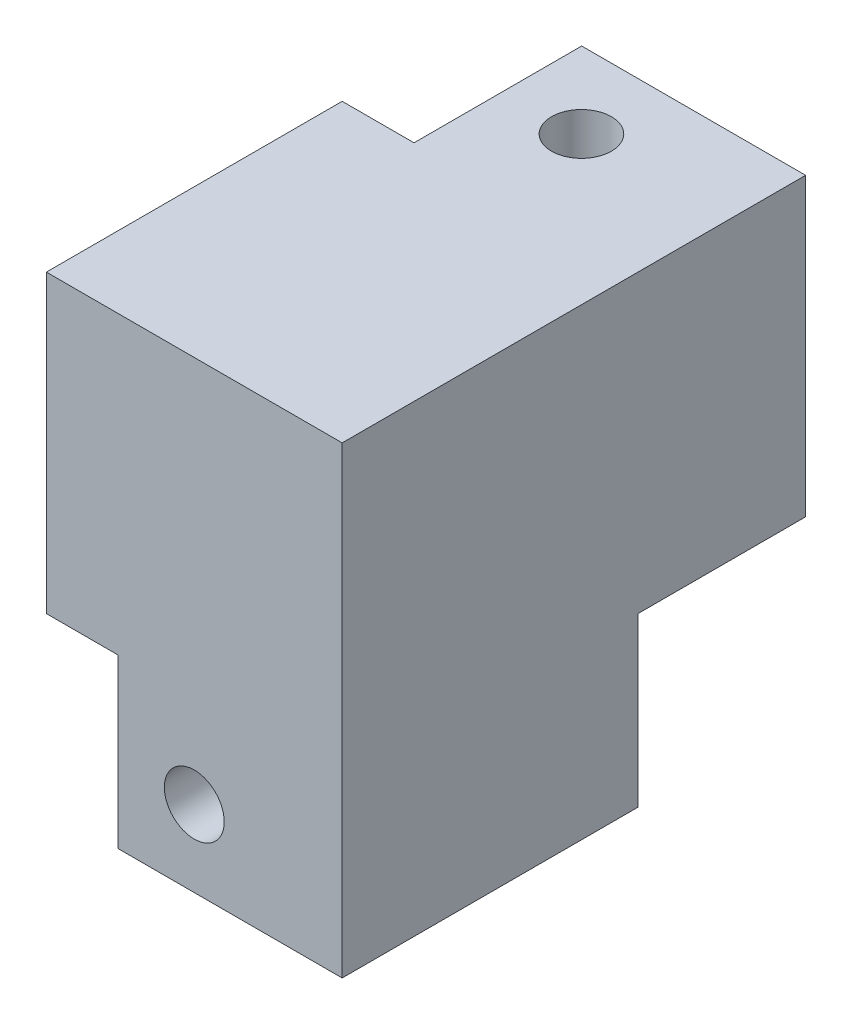
from build123d import *

# Parameters (mm, degrees)
SKETCH_1_W          = 24.7
SKETCH_1_H          = 24.7
SKETCH_1_W_2        = 12.7
SKETCH_1_H_2        = 12.7
EXTRUDE_2_DEPTH     = 24.7
EXTRUDE_3_DEPTH     = 14
EXTRUDE_4_DEPTH     = 14
SKETCH_5_R          = 2.5
CUT_EXTRUDE_1_DEPTH = 49.420398594
SKETCH_6_R          = 2.5
CUT_EXTRUDE_2_DEPTH = 48.542638757


with BuildPart() as part:
    # 草图1 → 凸台-拉伸2 (new body)
    # profile 1 of 2: a face of its own
    with BuildSketch(Plane(origin=(0, 0, 0), x_dir=(1, 0, 0), z_dir=(0, 1, 0))):
        Rectangle(SKETCH_1_W, SKETCH_1_H)
        Rectangle(SKETCH_1_W_2, SKETCH_1_H_2, mode=Mode.SUBTRACT)
    # profile 2 of 2: a face of its own
    with BuildSketch(Plane(origin=(0, 0, 0), x_dir=(1, 0, 0), z_dir=(0, 1, 0))):
        Rectangle(SKETCH_1_W_2, SKETCH_1_H_2)
    extrude(amount=EXTRUDE_2_DEPTH)

    # 草图3 → 凸台-拉伸3 (add)
    with BuildSketch(Plane.XZ):
        Polygon((-6.35, 12.35), (-6.35, 6.35), (6.35, 6.35), (6.35, -6.35), (-6.35, -6.35), (-6.35, -12.35), (12.35, -12.35), (12.35, 12.35), align=None)
    extrude(amount=EXTRUDE_3_DEPTH)

    # 草图4 → 凸台-拉伸4 (add)
    with BuildSketch(Plane(origin=(0, 0, -12.35), x_dir=(-1, 0, 0), z_dir=(0, 0, -1))):
        Polygon((6.35, 6), (-6.35, 6), (-6.35, 18.7), (6.35, 18.7), (6.35, 24.7), (-12.35, 24.7), (-12.35, 0), (6.35, 0), align=None)
    extrude(amount=EXTRUDE_4_DEPTH)

    # 草图5 → 切除-拉伸1 (cut, through all)
    with BuildSketch(Plane(origin=(0, 24.7, 0), x_dir=(1, 0, 0), z_dir=(0, 1, 0))):
        with Locations(Location((0, 19.98, 0), (0, 0, 270))):
            Circle(SKETCH_5_R)
    extrude(amount=-CUT_EXTRUDE_1_DEPTH, mode=Mode.SUBTRACT)

    # 草图6 → 切除-拉伸2 (cut, through all)
    with BuildSketch(Plane.XY.offset(12.35)):
        with Locations((0, -7.63)):
            Circle(SKETCH_6_R)
    extrude(amount=-CUT_EXTRUDE_2_DEPTH, mode=Mode.SUBTRACT)


solid = part.part
